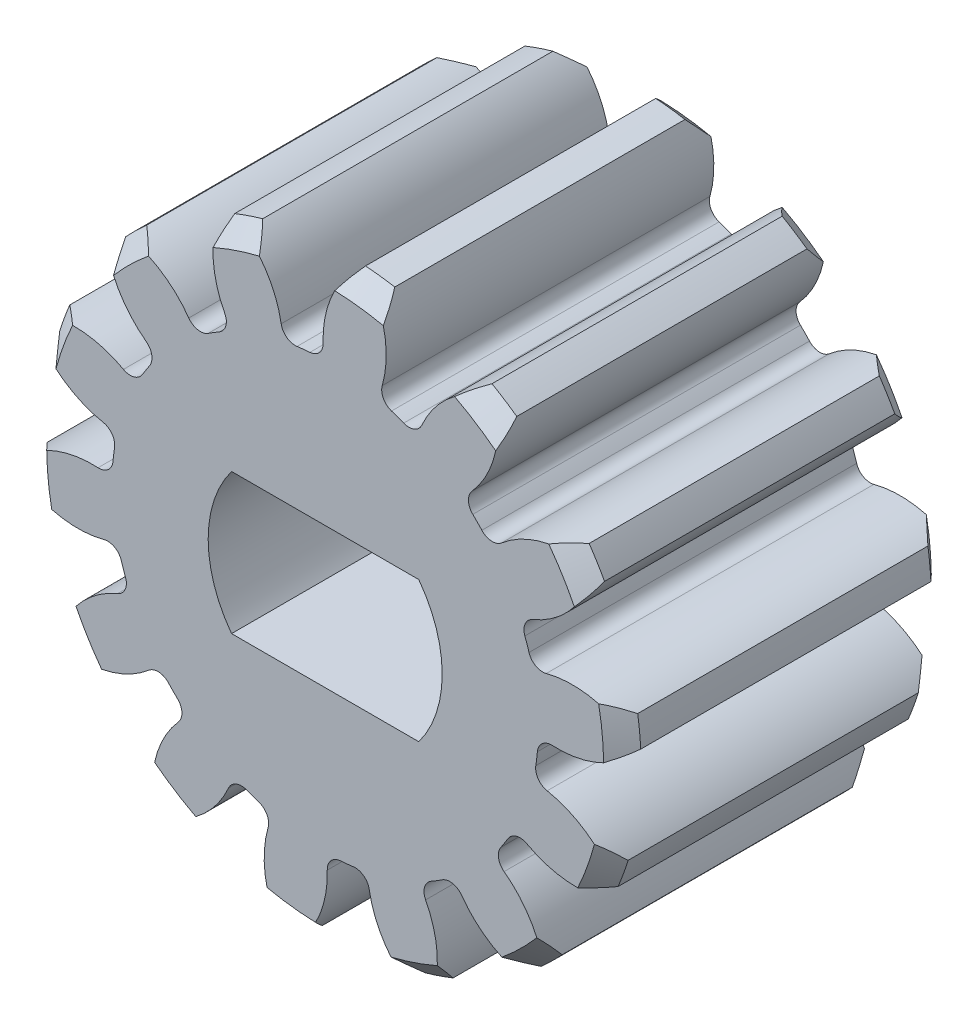
from build123d import *

# Parameters (mm, degrees)
SKETCH3_R          = 6.35
GEARBODY_DEPTH     = 7
CHAMFER1_SIZE      = 0.4
TOOTHCUT_DEPTH     = 12.386175829
CIRPATTERN1_COUNT  = 14
CUT_EXTRUDE1_DEPTH = 10


with BuildPart() as part:
    # Sketch3 → gearBody (new body)
    with BuildSketch(Plane.XY):
        Circle(SKETCH3_R)
    extrude(amount=GEARBODY_DEPTH)

    # Chamfer1
    chamfer1_edges = [part.edges().sort_by_distance(p)[0] for p in [
        (-6.35, 0, 0),
        (-6.35, 0, 7),
    ]]
    chamfer(chamfer1_edges, length=CHAMFER1_SIZE)

    # Sketch2 → toothCut (cut, through all)
    with BuildSketch(Plane.XY):
        with BuildLine():
            ThreePointArc((4.499933223, -0.692787621), (4.518896086, -0.555816394), (4.53369073, -0.418332484))
            ThreePointArc((4.53369073, -0.418332484), (4.637512654, -0.21647088), (4.852282357, -0.14297888))
            ThreePointArc((4.852282357, -0.14297888), (5.947454931, 0.082511242), (6.79115207, 0.816284982))
            ThreePointArc((6.79115207, 0.816284982), (6.78887396, -0.835019743), (6.390922796, -2.437657366))
            ThreePointArc((6.390922796, -2.437657366), (5.750188782, -1.521301165), (4.742302282, -1.037138418))
            ThreePointArc((4.742302282, -1.037138418), (4.5517434, -0.913791704), (4.499933223, -0.692787621))
        make_face()
    toothcut = extrude(amount=TOOTHCUT_DEPTH, mode=Mode.SUBTRACT)

    # CirPattern1: toothCut ×14 about axis
    cirpattern1_axis = Axis((0, 0, 0), (0, 0, 1))
    for i in range(1, CIRPATTERN1_COUNT):
        add(toothcut.rotate(cirpattern1_axis, i * 360 / CIRPATTERN1_COUNT), mode=Mode.SUBTRACT)

    # Sketch4 → Cut-Extrude1 (cut)
    with BuildSketch(Plane(origin=(0, 0, 0), x_dir=(-1, 0, 0), z_dir=(0, 0, -1))):
        with BuildLine():
            Line((-2, 1.5), (2, 1.5))
            ThreePointArc((2, 1.5), (2.5, 0), (2, -1.5))
            Line((2, -1.5), (-2, -1.5))
            ThreePointArc((-2, -1.5), (-2.5, 0), (-2, 1.5))
        make_face()
    extrude(amount=-CUT_EXTRUDE1_DEPTH, mode=Mode.SUBTRACT)


solid = part.part
